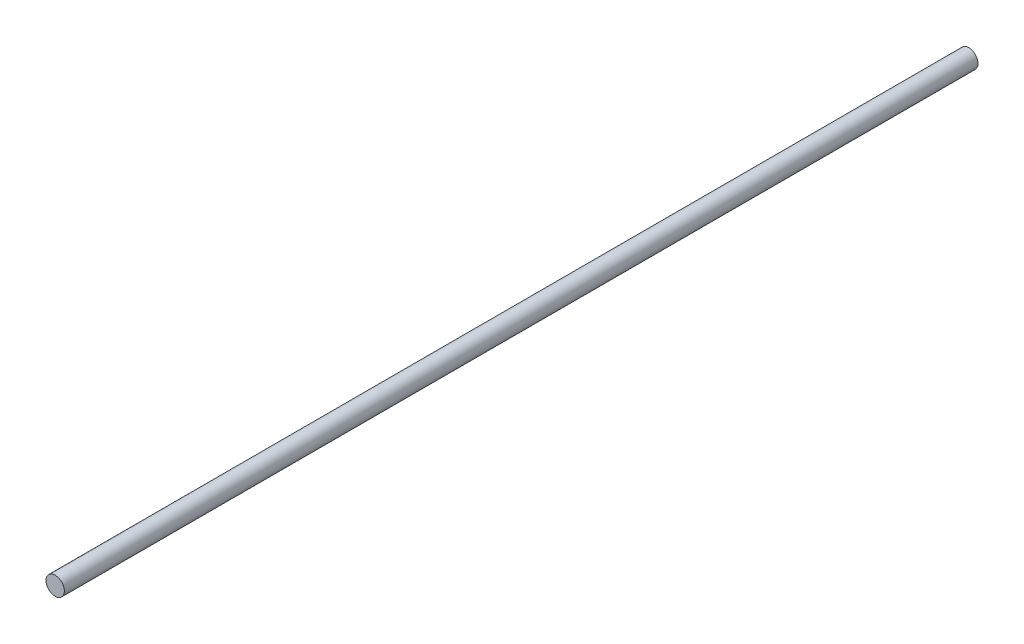
from build123d import *

# Parameters (mm, degrees)
IZIM1_R                     = 6
Y_KSEKLIK_EKSTR_ZYON1_DEPTH = 598


with BuildPart() as part:
    # Çizim1 → Yükseklik-Ekstrüzyon1 (new body)
    with BuildSketch(Plane.XY):
        Circle(IZIM1_R)
    extrude(amount=Y_KSEKLIK_EKSTR_ZYON1_DEPTH)


solid = part.part
